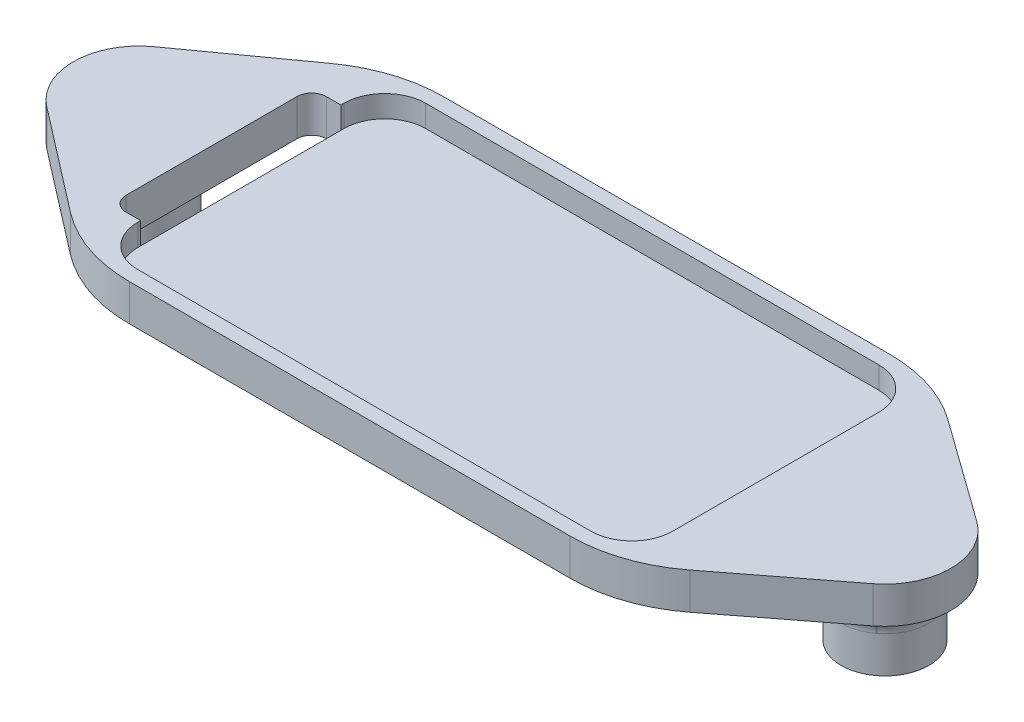
from build123d import *

# Parameters (mm, degrees)
SKETCH_1_W          = 2
SKETCH_1_H          = 13.69
EXTRUDE_1_DEPTH     = 1
EXTRUDE_START       = 1
SKETCH_1_3_R        = 4.499438526
SKETCH_1_3_R_2      = 3
SKETCH_1_3_W        = 4.417890806
SKETCH_1_3_H        = 1
SKETCH_1_3_W_2      = 11.749439362
SKETCH_1_3_H_2      = 0.999974731
EXTRUDE_2_DEPTH     = 1.5
FILLET_1_R          = 1
SKETCH_1_4_R        = 3
EXTRUDE_3_DEPTH     = 4
SKETCH_4_R          = 1.65
CUT_EXTRUDE_1_DEPTH = 2.5
FILLET_2_R          = 1.5
FILLET_3_R          = 10
SKETCH_9_R          = 3
EXTRUDE_6_DEPTH     = 4
SKETCH_10_R         = 2
CUT_EXTRUDE_3_DEPTH = 2.5
FILLET_5_R          = 1.5


with BuildPart() as part:
    # 草图1 → 凸台-拉伸1 (new body)
    with BuildSketch(Plane(origin=(0, 0, 0), x_dir=(1, 0, 0), z_dir=(0, 1, 0))):
        with BuildLine():
            Line((18.474806794, -10.844974731), (28.247830948, -3.308032201))
            ThreePointArc((28.247830948, -3.308032201), (29.998869582, 0.33088638), (28.126002395, 3.908627739))
            Line((28.126002395, 3.908627739), (18.474816537, 10.845))
            Line((18.474816537, 10.845), (-18.474816537, 10.845))
            Line((-18.474816537, 10.845), (-28.126002395, 3.908627739))
            ThreePointArc((-28.126002395, 3.908627739), (-29.998869582, 0.330886398), (-28.247830977, -3.308032179))
            Line((-28.247830977, -3.308032179), (-18.474806794, -10.844974731))
            Line((-18.474806794, -10.844974731), (18.474806794, -10.844974731))
        make_face()
        with Locations((-19.29, 0)):
            Rectangle(SKETCH_1_W, SKETCH_1_H, mode=Mode.SUBTRACT)
    extrude(amount=EXTRUDE_1_DEPTH)

    # 草图1<3> → 凸台-拉伸2 (add)
    # profile 1 of 10: a face of its own
    with BuildSketch(Plane(origin=(0, 0, 0), x_dir=(1, 0, 0), z_dir=(0, 1, 0)).offset(EXTRUDE_START)):
        with Locations((-25.50007206, 0.254939612)):
            Circle(SKETCH_1_3_R)
        with Locations((-25.50007206, 0.254939612)):
            Circle(SKETCH_1_3_R_2, mode=Mode.SUBTRACT)
    # profile 2 of 10: a face of its own
    with BuildSketch(Plane(origin=(0, 0, 0), x_dir=(1, 0, 0), z_dir=(0, 1, 0)).offset(EXTRUDE_START)):
        with Locations((-25.50007206, 0.254939612)):
            Circle(SKETCH_1_3_R_2)
    # profile 3 of 10: a face of its own
    with BuildSketch(Plane(origin=(0, 0, 0), x_dir=(1, 0, 0), z_dir=(0, 1, 0)).offset(EXTRUDE_START)):
        with BuildLine():
            Line((-19.79, 6.845), (-19.79, 9.89976879))
            Line((-19.79, 9.89976879), (-28.126002395, 3.908627739))
            ThreePointArc((-28.126002395, 3.908627739), (-23.44705782, 4.258697795), (-21.000633534, 0.254939612))
            ThreePointArc((-21.000633534, 0.254939612), (-23.514930413, -3.782901357), (-28.247830977, -3.308032179))
            Line((-28.247830977, -3.308032179), (-19.79, -9.830699574))
            Line((-19.79, -9.830699574), (-19.79, -6.845))
            Line((-19.79, -6.845), (-20.29, -6.845))
            Line((-20.29, -6.845), (-20.29, 6.845))
            Line((-20.29, 6.845), (-19.79, 6.845))
        make_face()
    # profile 4 of 10: a face of its own
    with BuildSketch(Plane(origin=(0, 0, 0), x_dir=(1, 0, 0), z_dir=(0, 1, 0)).offset(EXTRUDE_START)):
        with BuildLine():
            Line((-18.474816537, 10.845), (-19.79, 9.89976879))
            Line((-19.79, 9.89976879), (-19.79, 6.845))
            Line((-19.79, 6.845), (-18.29, 6.845))
            Line((-18.29, 6.845), (-18.29, 7.045))
            ThreePointArc((-18.29, 7.045), (-17.469898987, 9.024898987), (-15.49, 9.845))
            Line((-15.49, 9.845), (-4.417890806, 9.845))
            Line((-4.417890806, 9.845), (-4.417890806, 10.845))
            Line((-4.417890806, 10.845), (-18.474816537, 10.845))
        make_face()
    # profile 5 of 10: a face of its own
    with BuildSketch(Plane(origin=(0, 0, 0), x_dir=(1, 0, 0), z_dir=(0, 1, 0)).offset(EXTRUDE_START)):
        with Locations((-2.208945403, 10.345)):
            Rectangle(SKETCH_1_3_W, SKETCH_1_3_H)
    # profile 6 of 10: a face of its own
    with BuildSketch(Plane(origin=(0, 0, 0), x_dir=(1, 0, 0), z_dir=(0, 1, 0)).offset(EXTRUDE_START)):
        with BuildLine():
            Line((-19.79, -6.845), (-19.79, -9.830699574))
            Line((-19.79, -9.830699574), (-18.474806794, -10.844974731))
            Line((-18.474806794, -10.844974731), (-11.749439362, -10.844974731))
            Line((-11.749439362, -10.844974731), (-11.749439362, -9.845))
            Line((-11.749439362, -9.845), (-15.49, -9.845))
            ThreePointArc((-15.49, -9.845), (-17.469898987, -9.024898987), (-18.29, -7.045))
            Line((-18.29, -7.045), (-18.29, -6.845))
            Line((-18.29, -6.845), (-19.79, -6.845))
        make_face()
    # profile 7 of 10: a face of its own
    with BuildSketch(Plane(origin=(0, 0, 0), x_dir=(1, 0, 0), z_dir=(0, 1, 0)).offset(EXTRUDE_START)):
        with Locations((-5.874719681, -10.344987365)):
            Rectangle(SKETCH_1_3_W_2, SKETCH_1_3_H_2)
    # profile 8 of 10: a face of its own
    with BuildSketch(Plane(origin=(0, 0, 0), x_dir=(1, 0, 0), z_dir=(0, 1, 0)).offset(EXTRUDE_START)):
        with BuildLine():
            Line((18.474816537, 10.845), (0, 10.845))
            Line((0, 10.845), (0, 9.845))
            Line((0, 9.845), (15.49, 9.845))
            ThreePointArc((15.49, 9.845), (17.469898987, 9.024898987), (18.29, 7.045))
            Line((18.29, 7.045), (18.29, -7.045))
            ThreePointArc((18.29, -7.045), (17.469898987, -9.024898987), (15.49, -9.845))
            Line((15.49, -9.845), (0, -9.845))
            Line((0, -9.845), (0, -10.844974731))
            Line((0, -10.844974731), (18.474806794, -10.844974731))
            Line((18.474806794, -10.844974731), (19.79, -9.830699574))
            Line((19.79, -9.830699574), (19.79, 9.89976879))
            Line((19.79, 9.89976879), (18.474816537, 10.845))
        make_face()
    # profile 9 of 10: a face of its own
    with BuildSketch(Plane(origin=(0, 0, 0), x_dir=(1, 0, 0), z_dir=(0, 1, 0)).offset(EXTRUDE_START)):
        with BuildLine():
            Line((28.126002395, 3.908627739), (19.79, 9.89976879))
            Line((19.79, 9.89976879), (19.79, -9.830699574))
            Line((19.79, -9.830699574), (28.247830948, -3.308032201))
            ThreePointArc((28.247830948, -3.308032201), (21.001274538, 0.178992845), (28.126002395, 3.908627739))
        make_face()
    # profile 10 of 10: a face of its own
    with BuildSketch(Plane(origin=(0, 0, 0), x_dir=(1, 0, 0), z_dir=(0, 1, 0)).offset(EXTRUDE_START)):
        with Locations((25.50007206, 0.254939612)):
            Circle(SKETCH_1_3_R)
    extrude(amount=EXTRUDE_2_DEPTH)

    # 圆角1
    fillet_1_edges = [part.edges().sort_by_distance(p)[0] for p in [
        (-20.29, 1.25, -6.845),
        (-20.29, 1.25, 6.845),
    ]]
    fillet(fillet_1_edges, radius=FILLET_1_R)

    # 草图1<4> → 凸台-拉伸3 (add)
    with BuildSketch(Plane(origin=(0, 0, 0), x_dir=(1, 0, 0), z_dir=(0, 1, 0))):
        with Locations(Location((-25.50007206, 0.254939612, 0), (0, 0, 270))):
            Circle(SKETCH_1_4_R)
    extrude(amount=-EXTRUDE_3_DEPTH)

    # 草图4 → 切除-拉伸1 (cut)
    with BuildSketch(Plane.XZ.offset(4)):
        with Locations(Location((-25.50007206, -0.254939612, 0), (0, 0, 270))):
            Circle(SKETCH_4_R)
        with Locations((25.5, -0.255)):
            Circle(SKETCH_4_R)
    extrude(amount=-CUT_EXTRUDE_1_DEPTH, mode=Mode.SUBTRACT)

    # 圆角2
    fillet_2_edges = [part.edges().sort_by_distance(p)[0] for p in [
        (-25.50007206, 0, -3.254939612),
    ]]
    fillet(fillet_2_edges, radius=FILLET_2_R)

    # 圆角3
    fillet_3_edges = [part.edges().sort_by_distance(p)[0] for p in [
        (-18.474806794, 1.25, 10.844974731),
        (-18.474816537, 1.25, -10.845),
        (18.474816537, 1.25, -10.845),
        (18.474806794, 1.25, 10.844974731),
    ]]
    fillet(fillet_3_edges, radius=FILLET_3_R)

    # 草图9 → 凸台-拉伸6 (add)
    with BuildSketch(Plane.XZ):
        with Locations(Location((25.50007206, -0.254939612, 0), (0, 0, 90))):
            Circle(SKETCH_9_R)
    extrude(amount=EXTRUDE_6_DEPTH)

    # 草图10 → 切除-拉伸3 (cut)
    with BuildSketch(Plane.XZ.offset(4)):
        with Locations(Location((25.50007206, -0.254939612, 0), (0, 0, 270))):
            Circle(SKETCH_10_R)
    extrude(amount=-CUT_EXTRUDE_3_DEPTH, mode=Mode.SUBTRACT)

    # 圆角5
    fillet_5_edges = [part.edges().sort_by_distance(p)[0] for p in [
        (25.50007206, 0, -3.254939612),
    ]]
    fillet(fillet_5_edges, radius=FILLET_5_R)


solid = part.part
